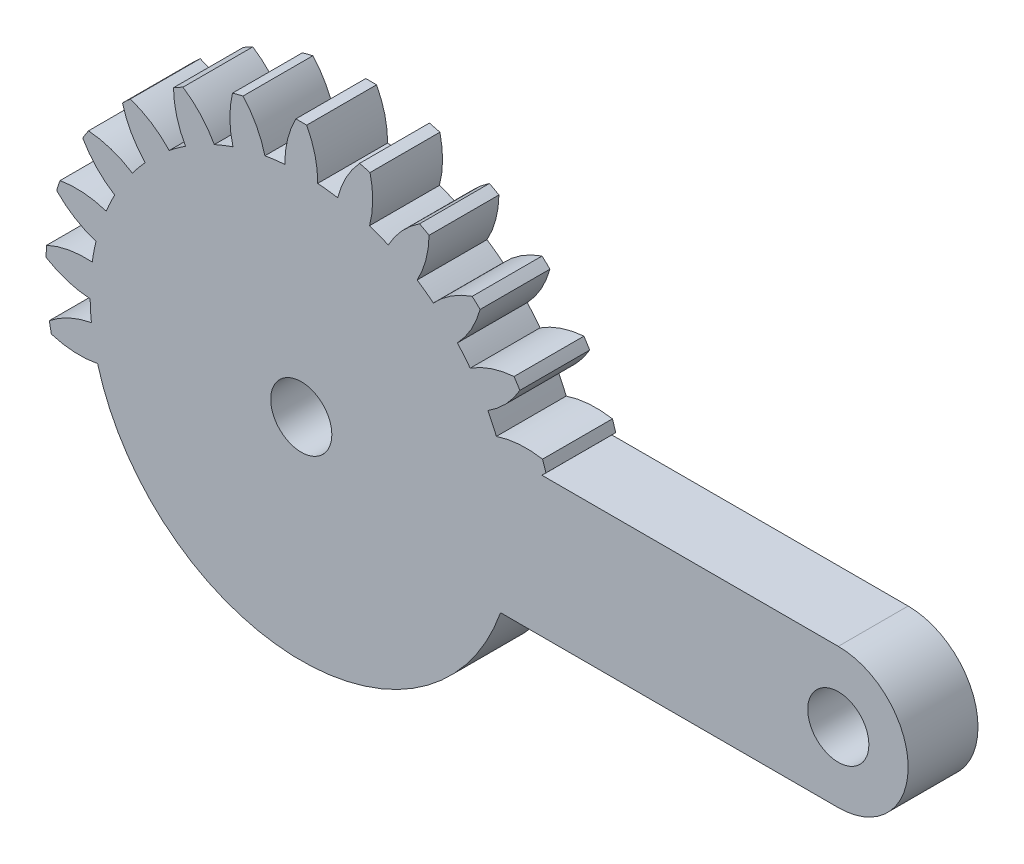
from build123d import *

# Parameters (mm, degrees)
SKETCH1_R           = 1.75
BOSS_EXTRUDE1_DEPTH = 4


with BuildPart() as part:
    # Sketch1 → Boss-Extrude1 (new body)
    with BuildSketch(Plane.XY):
        with BuildLine():
            ThreePointArc((13.776114953, 4), (13.893050478, 4.110818553), (14.006628151, 4.225076075))
            ThreePointArc((14.006628151, 4.225076075), (13.913956833, 4.520918628), (13.815037615, 4.814731115))
            ThreePointArc((13.815037615, 4.814731115), (12.481386111, 4.882828881), (11.171803009, 4.621570895))
            ThreePointArc((11.171803009, 4.621570895), (10.939359064, 5.147671635), (10.682156823, 5.662122005))
            ThreePointArc((10.682156823, 5.662122005), (11.718219248, 6.50464102), (12.515850479, 7.575644315))
            ThreePointArc((12.515850479, 7.575644315), (12.35251755, 7.839146011), (12.183637866, 8.099127629))
            ThreePointArc((12.183637866, 8.099127629), (10.874950252, 7.833420336), (9.671482329, 7.254690176))
            ThreePointArc((9.671482329, 7.254690176), (9.315505105, 7.706456036), (8.938444741, 8.140780406))
            ThreePointArc((8.938444741, 8.140780406), (9.7324314, 9.214488384), (10.238655891, 10.450206961))
            ThreePointArc((10.238655891, 10.450206961), (10.01492416, 10.664811019), (9.786695342, 10.874626167))
            ThreePointArc((9.786695342, 10.874626167), (8.585201272, 10.291809183), (7.563466846, 9.431970593))
            ThreePointArc((7.563466846, 9.431970593), (7.1063237, 9.781015462), (6.633097302, 10.107923633))
            ThreePointArc((6.633097302, 10.107923633), (7.135119095, 11.345355554), (7.318128899, 12.668144672))
            ThreePointArc((7.318128899, 12.668144672), (7.048056252, 12.820366729), (6.774818757, 12.966831949))
            ThreePointArc((6.774818757, 12.966831949), (5.756012523, 12.103525808), (4.980210924, 11.016605609))
            ThreePointArc((4.980210924, 11.016605609), (4.450625842, 11.240997714), (3.910967965, 11.439948845))
            ThreePointArc((3.910967965, 11.439948845), (4.089481015, 12.763352309), (3.937776954, 14.090096262))
            ThreePointArc((3.937776954, 14.090096262), (3.638333049, 14.170371647), (3.337255394, 14.244283992))
            ThreePointArc((3.337255394, 14.244283992), (2.565152337, 13.154733392), (2.084030034, 11.909026779))
            ThreePointArc((2.084030034, 11.909026779), (1.515278794, 11.994666739), (0.943098128, 12.053159997))
            ThreePointArc((0.943098128, 12.053159997), (0.786885803, 13.379380698), (0.31, 14.626715284))
            ThreePointArc((0.31, 14.626715284), (0, 14.63), (-0.31, 14.626715284))
            ThreePointArc((-0.31, 14.626715284), (-0.786885803, 13.379380698), (-0.943098128, 12.053159997))
            ThreePointArc((-0.943098128, 12.053159997), (-1.515278794, 11.994666739), (-2.084030034, 11.909026779))
            ThreePointArc((-2.084030034, 11.909026779), (-2.565152337, 13.154733392), (-3.337255394, 14.244283992))
            ThreePointArc((-3.337255394, 14.244283992), (-3.638333049, 14.170371647), (-3.937776954, 14.090096262))
            ThreePointArc((-3.937776954, 14.090096262), (-4.089481015, 12.763352309), (-3.910967965, 11.439948845))
            ThreePointArc((-3.910967965, 11.439948845), (-4.450625842, 11.240997714), (-4.980210924, 11.016605609))
            ThreePointArc((-4.980210924, 11.016605609), (-5.756012523, 12.103525808), (-6.774818757, 12.966831949))
            ThreePointArc((-6.774818757, 12.966831949), (-7.048056252, 12.820366729), (-7.318128899, 12.668144672))
            ThreePointArc((-7.318128899, 12.668144672), (-7.135119095, 11.345355554), (-6.633097302, 10.107923633))
            ThreePointArc((-6.633097302, 10.107923633), (-7.1063237, 9.781015462), (-7.563466846, 9.431970593))
            ThreePointArc((-7.563466846, 9.431970593), (-8.585201272, 10.291809183), (-9.786695342, 10.874626167))
            ThreePointArc((-9.786695342, 10.874626167), (-10.01492416, 10.664811019), (-10.238655891, 10.450206961))
            ThreePointArc((-10.238655891, 10.450206961), (-9.7324314, 9.214488384), (-8.938444741, 8.140780406))
            ThreePointArc((-8.938444741, 8.140780406), (-9.315505105, 7.706456036), (-9.671482329, 7.254690176))
            ThreePointArc((-9.671482329, 7.254690176), (-10.874950252, 7.833420336), (-12.183637866, 8.099127629))
            ThreePointArc((-12.183637866, 8.099127629), (-12.35251755, 7.839146011), (-12.515850479, 7.575644315))
            ThreePointArc((-12.515850479, 7.575644315), (-11.718219248, 6.50464102), (-10.682156823, 5.662122005))
            ThreePointArc((-10.682156823, 5.662122005), (-10.939359064, 5.147671635), (-11.171803009, 4.621570895))
            ThreePointArc((-11.171803009, 4.621570895), (-12.481386111, 4.882828881), (-13.815037615, 4.814731115))
            ThreePointArc((-13.815037615, 4.814731115), (-13.913956833, 4.520918628), (-14.006628151, 4.225076075))
            ThreePointArc((-14.006628151, 4.225076075), (-12.967708283, 3.386083139), (-11.754669706, 2.827691655))
            ThreePointArc((-11.754669706, 2.827691655), (-11.875852861, 2.265440093), (-11.970158218, 1.698061317))
            ThreePointArc((-11.970158218, 1.698061317), (-13.303570578, 1.625431329), (-14.578387742, 1.227807338))
            ThreePointArc((-14.578387742, 1.227807338), (-14.601131037, 0.918625301), (-14.617317864, 0.609030766))
            ThreePointArc((-14.617317864, 0.609030766), (-13.402388515, 0.054765201), (-12.088593461, -0.184412961))
            ThreePointArc((-12.088593461, -0.184412961), (-12.066143147, -0.759137381), (-12.016384363, -1.332143698))
            ThreePointArc((-12.016384363, -1.332143698), (-13.289842779, -1.734098051), (-14.425724151, -2.43626409))
            ThreePointArc((-14.425724151, -2.43626409), (-14.370862478, -2.741388632), (-14.309547736, -3.045282186))
            ThreePointArc((-14.309547736, -3.045282186), (-12.994947386, -3.279993836), (-11.662946429, -3.184930232))
            ThreePointArc((-11.662946429, -3.184930232), (-0.426838607, -12.082462862), (11.409123542, -4))
            Line((11.409123542, -4), (30.75, -4))
            ThreePointArc((30.75, -4), (34.75, 0), (30.75, 4))
            Line((30.75, 4), (13.776114953, 4))
        make_face()
        Circle(SKETCH1_R, mode=Mode.SUBTRACT)
        with Locations((30.75, 0)):
            Circle(SKETCH1_R, mode=Mode.SUBTRACT)
    extrude(amount=BOSS_EXTRUDE1_DEPTH)


solid = part.part
